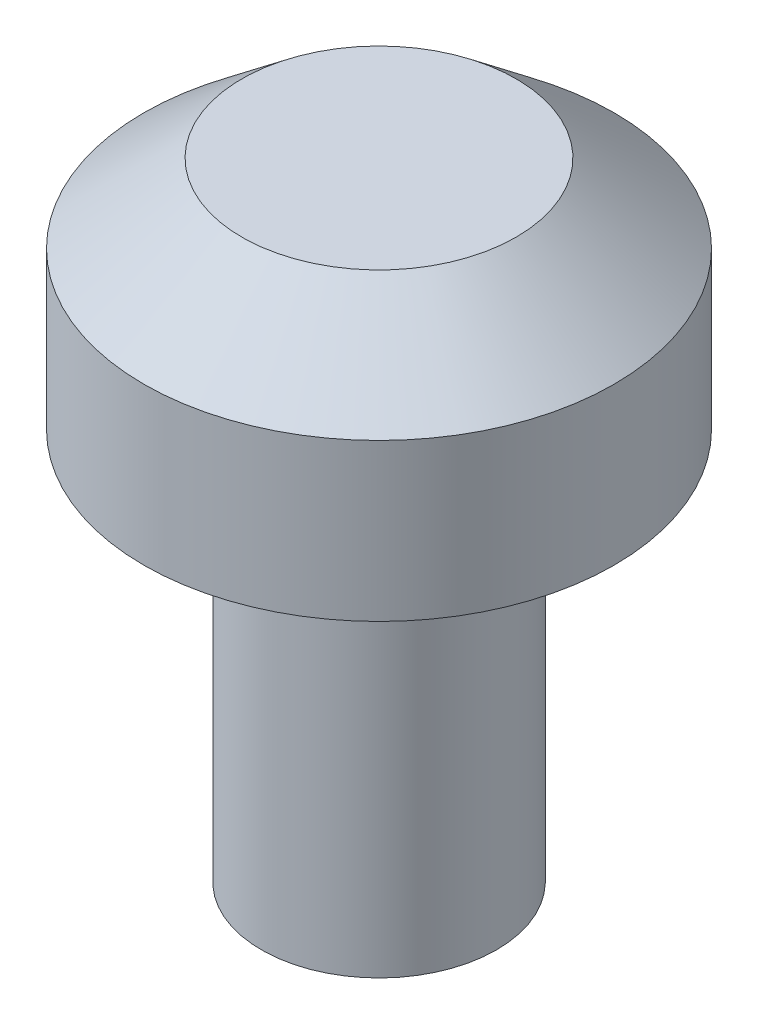
from build123d import *


with BuildPart() as part:
    # Croquis3 → Revolución1 (revolve)
    with BuildSketch(Plane.XY, mode=Mode.PRIVATE) as revoluci_n1_sk:
        Polygon((0, 0), (-1.5, 0), (-1.5, 5), (-3, 5), (-3, 7), (-1.75, 8), (0, 8), align=None)
    revolve(revoluci_n1_sk.sketch.rotate(Axis((0, 0, 0), (0, 1, 0)), 180), axis=Axis((0, 0, 0), (0, 1, 0)))


solid = part.part
